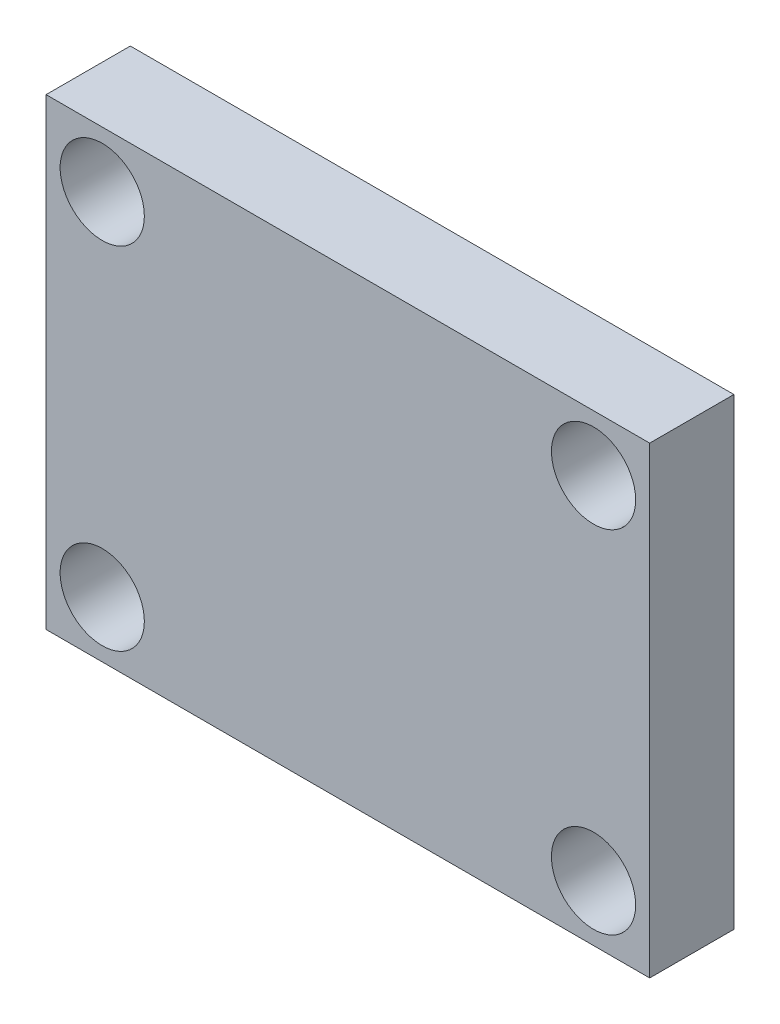
from build123d import *

# Parameters (mm, degrees)
SKETCH1_W           = 21.5
SKETCH1_H           = 16.5
SKETCH1_R           = 1.5
BOSS_EXTRUDE1_DEPTH = 3


with BuildPart() as part:
    # Sketch1 → Boss-Extrude1 (new body)
    with BuildSketch(Plane.XY):
        Rectangle(SKETCH1_W, SKETCH1_H)
        with Locations((-8.75, 6.25)):
            Circle(SKETCH1_R, mode=Mode.SUBTRACT)
        with Locations((8.75, 6.25)):
            Circle(SKETCH1_R, mode=Mode.SUBTRACT)
        with Locations((8.75, -6.25)):
            Circle(SKETCH1_R, mode=Mode.SUBTRACT)
        with Locations((-8.75, -6.25)):
            Circle(SKETCH1_R, mode=Mode.SUBTRACT)
    extrude(amount=BOSS_EXTRUDE1_DEPTH)


solid = part.part
